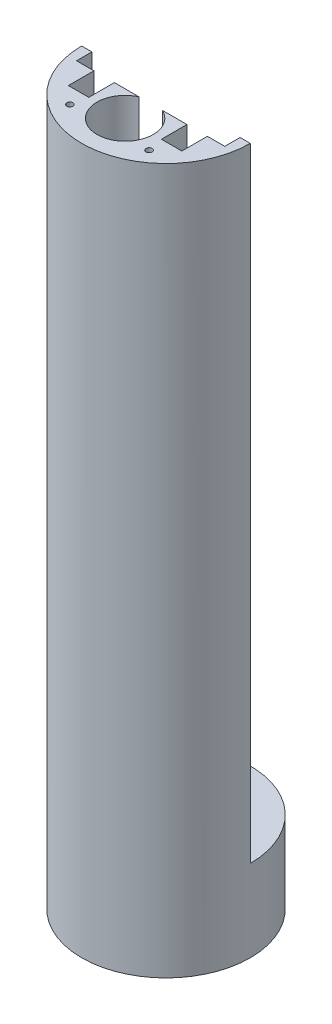
from build123d import *

# Parameters (mm, degrees)
SKETCH_1_R          = 16.5
EXTRUDE_1_DEPTH     = 6
SKETCH_2_R          = 4.25
CUT_EXTRUDE_1_DEPTH = 25.093567606
SKETCH_3_R          = 0.6
CUT_EXTRUDE_2_DEPTH = 3
SKETCH_4_R          = 16.5
SKETCH_4_R_2        = 5.5
EXTRUDE_2_DEPTH     = 10
SKETCH_5_R          = 5.5
EXTRUDE_3_DEPTH     = 122
SKETCH_6_W          = 29
SKETCH_6_H          = 40
SKETCH_6_W_2        = 10
SKETCH_6_H_2        = 20
CUT_EXTRUDE_3_DEPTH = 3
SKETCH_7_W          = 4
SKETCH_7_H          = 40
CUT_EXTRUDE_4_DEPTH = 5
SKETCH_8_R          = 0.4
CUT_EXTRUDE_5_DEPTH = 2
SKETCH_9_R          = 0.6
CUT_EXTRUDE_6_DEPTH = 2
SKETCH_10_R         = 0.6
CUT_EXTRUDE_7_DEPTH = 3
SKETCH_11_R         = 0.6
CUT_EXTRUDE_8_DEPTH = 3
SKETCH_12_R         = 1.5
CUT_EXTRUDE_9_DEPTH = 40


with BuildPart() as part:
    # 草图1 → 凸台-拉伸1 (new body)
    with BuildSketch(Plane(origin=(0, 0, 0), x_dir=(1, 0, 0), z_dir=(0, 1, 0))):
        with Locations(Location((0, 0, 0), (0, 0, 270))):
            Circle(SKETCH_1_R)
    extrude(amount=EXTRUDE_1_DEPTH)

    # 草图2 → 切除-拉伸1 (cut, through all)
    with BuildSketch(Plane(origin=(0, 6, 0), x_dir=(1, 0, 0), z_dir=(0, 1, 0))):
        with Locations(Location((0, -8, 0), (0, 0, 270))):
            Circle(SKETCH_2_R)
    extrude(amount=-CUT_EXTRUDE_1_DEPTH, mode=Mode.SUBTRACT)

    # 草图3 → 切除-拉伸2 (cut)
    with BuildSketch(Plane.XZ):
        with Locations(Location((-8.485281374, 8.485281374, 0), (0, 0, 270))):
            Circle(SKETCH_3_R)
        with Locations(Location((8.485281374, 8.485281374, 0), (0, 0, 270))):
            Circle(SKETCH_3_R)
        with Locations(Location((8.485281374, -8.485281374, 0), (0, 0, 270))):
            Circle(SKETCH_3_R)
        with Locations(Location((-8.485281374, -8.485281374, 0), (0, 0, 270))):
            Circle(SKETCH_3_R)
    extrude(amount=-CUT_EXTRUDE_2_DEPTH, mode=Mode.SUBTRACT)

    # 草图4 → 凸台-拉伸2 (add)
    with BuildSketch(Plane(origin=(0, 6, 0), x_dir=(1, 0, 0), z_dir=(0, 1, 0))):
        with Locations(Location((0, 0, 0), (0, 0, 270))):
            Circle(SKETCH_4_R)
        with Locations(Location((0, -8, 0), (0, 0, 270))):
            Circle(SKETCH_4_R_2, mode=Mode.SUBTRACT)
    extrude(amount=EXTRUDE_2_DEPTH)

    # 草图5 → 凸台-拉伸3 (add)
    with BuildSketch(Plane(origin=(0, 16, 0), x_dir=(1, 0, 0), z_dir=(0, 1, 0))):
        with BuildLine():
            ThreePointArc((-16.5, 0), (0, -16.5), (16.5, 0))
            Line((16.5, 0), (-16.5, 0))
        make_face()
        with Locations(Location((0, -8, 0), (0, 0, 270))):
            Circle(SKETCH_5_R, mode=Mode.SUBTRACT)
    extrude(amount=EXTRUDE_3_DEPTH)

    # 草图6 → 切除-拉伸3 (cut)
    with BuildSketch(Plane(origin=(0, 0, 0), x_dir=(-1, 0, 0), z_dir=(0, 0, -1))):
        with Locations((0, 118)):
            Rectangle(SKETCH_6_W, SKETCH_6_H)
        with Locations((0, 88)):
            Rectangle(SKETCH_6_W_2, SKETCH_6_H_2)
    extrude(amount=-CUT_EXTRUDE_3_DEPTH, mode=Mode.SUBTRACT)

    # 草图7 → 切除-拉伸4 (cut)
    with BuildSketch(Plane(origin=(0, 0, 3), x_dir=(-1, 0, 0), z_dir=(0, 0, -1))):
        with Locations((9.1, 118)):
            Rectangle(SKETCH_7_W, SKETCH_7_H)
        with Locations((-9.1, 118)):
            Rectangle(SKETCH_7_W, SKETCH_7_H)
    extrude(amount=-CUT_EXTRUDE_4_DEPTH, mode=Mode.SUBTRACT)

    # 草图8 → 切除-拉伸5 (cut)
    with BuildSketch(Plane(origin=(0, 0, 3), x_dir=(-1, 0, 0), z_dir=(0, 0, -1))):
        with Locations((-12.8, 133)):
            Circle(SKETCH_8_R)
        with Locations((-12.8, 110)):
            Circle(SKETCH_8_R)
        with Locations((12.8, 133)):
            Circle(SKETCH_8_R)
        with Locations((12.8, 110)):
            Circle(SKETCH_8_R)
    extrude(amount=-CUT_EXTRUDE_5_DEPTH, mode=Mode.SUBTRACT)

    # 草图9 → 切除-拉伸6 (cut)
    with BuildSketch(Plane(origin=(0, 0, 0), x_dir=(-1, 0, 0), z_dir=(0, 0, -1))):
        with Locations((0, 67)):
            Circle(SKETCH_9_R)
        with Locations((0, 47)):
            Circle(SKETCH_9_R)
    extrude(amount=-CUT_EXTRUDE_6_DEPTH, mode=Mode.SUBTRACT)

    # 草图10 → 切除-拉伸7 (cut)
    with BuildSketch(Plane(origin=(0, 0, 0), x_dir=(-1, 0, 0), z_dir=(0, 0, -1))):
        with Locations((-8.5, 87)):
            Circle(SKETCH_10_R)
        with Locations((8.5, 87)):
            Circle(SKETCH_10_R)
        with Locations((8.5, 27)):
            Circle(SKETCH_10_R)
        with Locations((-8.5, 27)):
            Circle(SKETCH_10_R)
    extrude(amount=-CUT_EXTRUDE_7_DEPTH, mode=Mode.SUBTRACT)

    # 草图11 → 切除-拉伸8 (cut)
    with BuildSketch(Plane(origin=(0, 138, 0), x_dir=(1, 0, 0), z_dir=(0, 1, 0))):
        with Locations(Location((7.743281891, -11.058552598, 0), (0, 0, 270))):
            Circle(SKETCH_11_R)
        with Locations(Location((-7.743281891, -11.058552598, 0), (0, 0, 270))):
            Circle(SKETCH_11_R)
    extrude(amount=-CUT_EXTRUDE_8_DEPTH, mode=Mode.SUBTRACT)

    # 草图12 → 切除-拉伸9 (cut)
    with BuildSketch(Plane(origin=(0, 0, 0), x_dir=(-1, 0, 0), z_dir=(0, -1, 0))):
        with Locations(Location((0, 0, 0), (0, 0, 90))):
            Circle(SKETCH_12_R)
    extrude(amount=-CUT_EXTRUDE_9_DEPTH, mode=Mode.SUBTRACT)


solid = part.part
